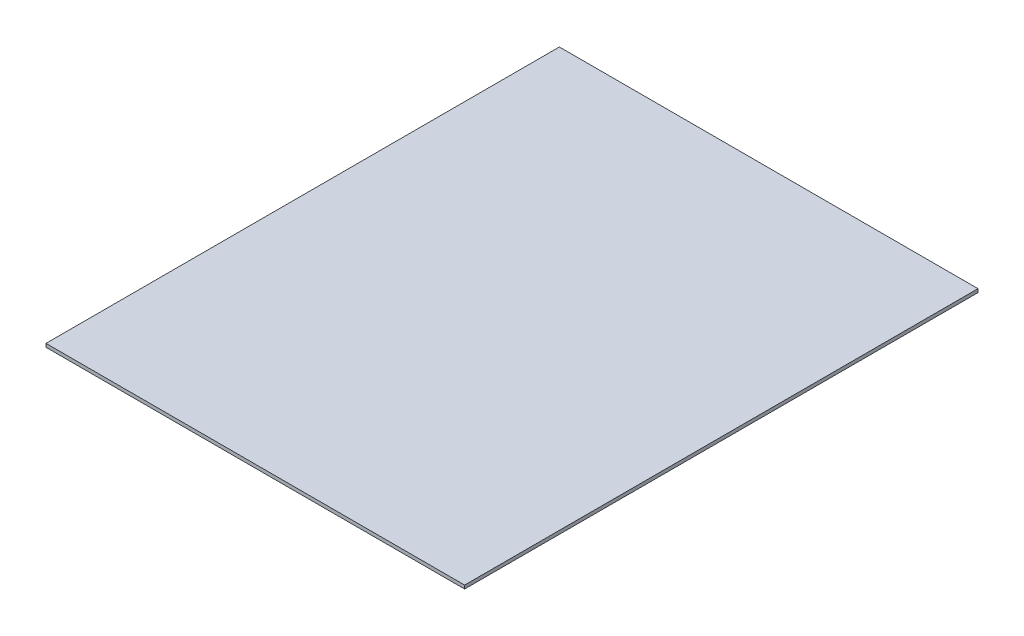
from build123d import *

# Parameters (mm, degrees)
SKETCH_1_W      = 6075
SKETCH_1_H      = 7450
EXTRUDE_1_DEPTH = 50


with BuildPart() as part:
    # 草图1 → 凸台-拉伸1 (new body)
    with BuildSketch(Plane(origin=(0, 0, 0), x_dir=(1, 0, 0), z_dir=(0, 1, 0))):
        Rectangle(SKETCH_1_W, SKETCH_1_H)
    extrude(amount=EXTRUDE_1_DEPTH)


solid = part.part
